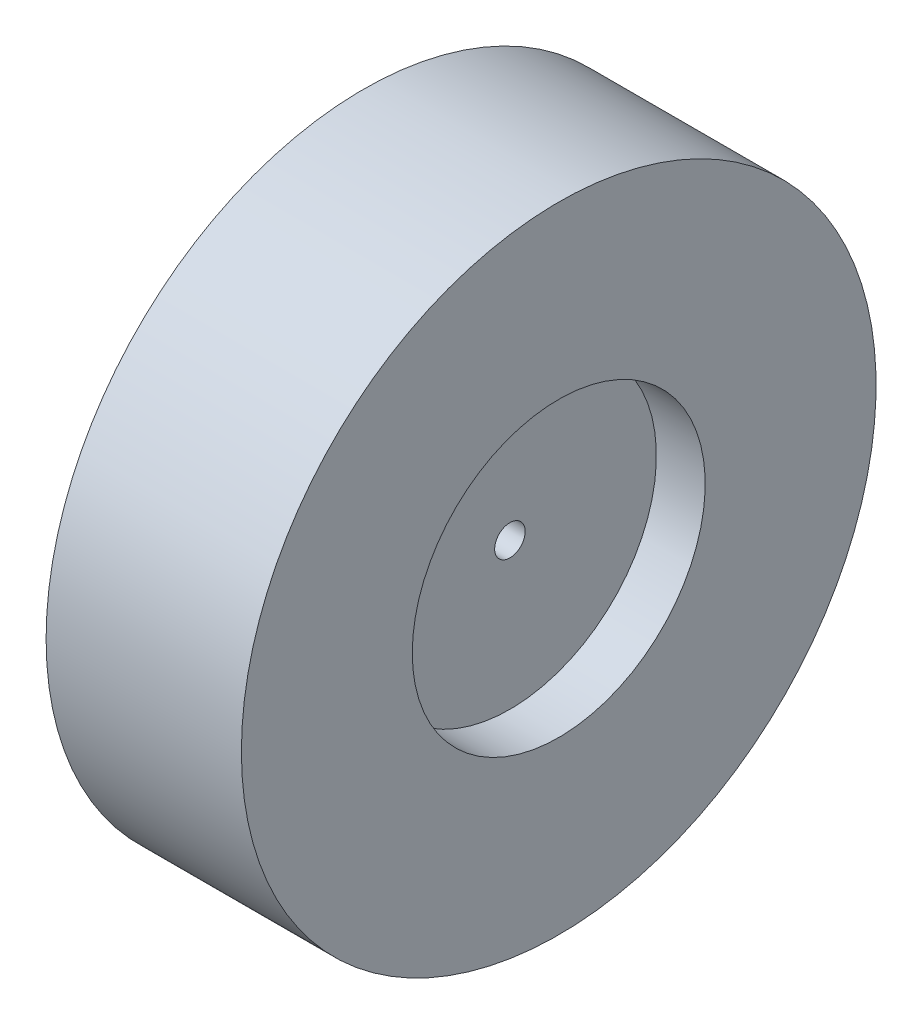
from build123d import *


with BuildPart() as part:
    # Sketch1 → Revolve1 (revolve)
    with BuildSketch(Plane(origin=(0, 0, 0), x_dir=(1, 0, 0), z_dir=(0, 1, 0)), mode=Mode.PRIVATE) as revolve1_sk:
        Polygon((-50.8, 76.2), (-50.8, 165.1), (50.8, 165.1), (50.8, 76.2), (25.4, 76.2), (25.4, 7.9375), (-25.4, 7.9375), (-25.4, 76.2), align=None)
    revolve(revolve1_sk.sketch.rotate(Axis((-25.4, 0, 0), (1, 0, 0)), 180), axis=Axis((-25.4, 0, 0), (1, 0, 0)))


solid = part.part
